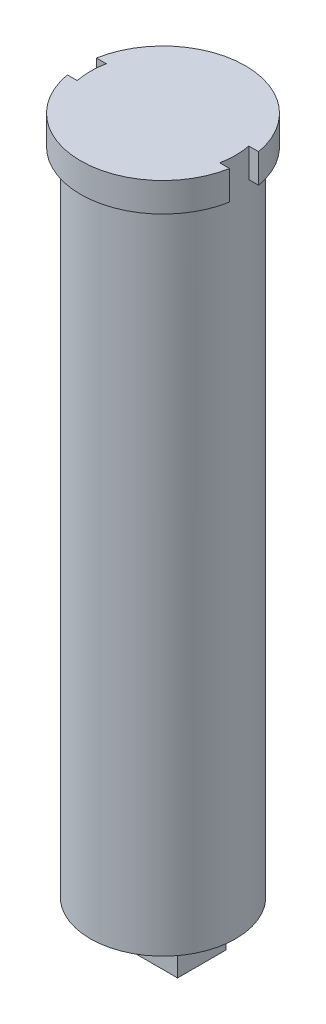
from build123d import *
from build123d.topology import SkipClean

# Parameters (mm, degrees)
BOSS_EXTRUDE1_DEPTH     = 3
BOSS_EXTRUDE2_START     = -67
SKETCH2_R               = 7.5
BOSS_EXTRUDE2_DEPTH     = 67
SKETCH4_W               = 8
SKETCH4_H               = 5
BOSS_EXTRUDE4_DEPTH     = 4
CUT_EXTRUDE1_DEPTH      = 72.994791478
CUT_EXTRUDE1_DEPTH_BACK = 72.994791478
SKETCH6_R               = 7.5
BOSS_EXTRUDE5_DEPTH     = 30


with BuildPart() as part:
    # Sketch1 → Boss-Extrude1 (new body)
    with BuildSketch(Plane(origin=(0, 0, 0), x_dir=(1, 0, 0), z_dir=(0, 1, 0))):
        with BuildLine():
            Line((-8.366600265, 1.5), (-7.348469228, 1.5))
            ThreePointArc((-7.348469228, 1.5), (-7.5, 0), (-7.348469228, -1.5))
            Line((-7.348469228, -1.5), (-8.366600265, -1.5))
            ThreePointArc((-8.366600265, -1.5), (0, -8.5), (8.366600265, -1.5))
            Line((8.366600265, -1.5), (7.348469228, -1.5))
            ThreePointArc((7.348469228, -1.5), (7.5, 0), (7.348469228, 1.5))
            Line((7.348469228, 1.5), (8.366600265, 1.5))
            ThreePointArc((8.366600265, 1.5), (0, 8.5), (-8.366600265, 1.5))
        make_face()
    extrude(amount=BOSS_EXTRUDE1_DEPTH)

    # Sketch2 → Boss-Extrude2 (add)
    with BuildSketch(Plane(origin=(0, 0, 0), x_dir=(1, 0, 0), z_dir=(0, 1, 0)).offset(BOSS_EXTRUDE2_START)):
        with Locations(Location((0, 0, 0), (0, 0, 168.463040967))):
            Circle(SKETCH2_R)
    extrude(amount=BOSS_EXTRUDE2_DEPTH)

    # Sketch4 → Boss-Extrude4 (add)
    with BuildSketch(Plane.XZ.offset(67)):
        Rectangle(SKETCH4_W, SKETCH4_H)
    extrude(amount=BOSS_EXTRUDE4_DEPTH)

    # Sketch5 → Cut-Extrude1 (cut, two sides: drawn at the far end of the back side and taken through both)
    with BuildSketch(Plane(origin=(0, 0, 0), x_dir=(0, 0, -1), z_dir=(1, 0, 0)).offset(-CUT_EXTRUDE1_DEPTH_BACK)):
        Polygon((-7.5, -51), (-3.5, -45), (-3.5, -44), (-7.5, -44), align=None)
        Polygon((7.5, -62), (3.5, -62), (3.5, -61), (7.5, -56), align=None)
    extrude(amount=CUT_EXTRUDE1_DEPTH + CUT_EXTRUDE1_DEPTH_BACK, mode=Mode.SUBTRACT)

    # Sketch6 → Boss-Extrude5 (add)
    with SkipClean():  # the faces are left unmerged after this step: merging them gives an invalid solid
        with BuildSketch(Plane(origin=(0, -67, 0), x_dir=(-1, 0, 0), z_dir=(0, -1, 0))):
            with Locations(Location((0, 0, 0), (0, 0, 11.536959033))):
                Circle(SKETCH6_R)
        extrude(amount=-BOSS_EXTRUDE5_DEPTH)


solid = part.part
